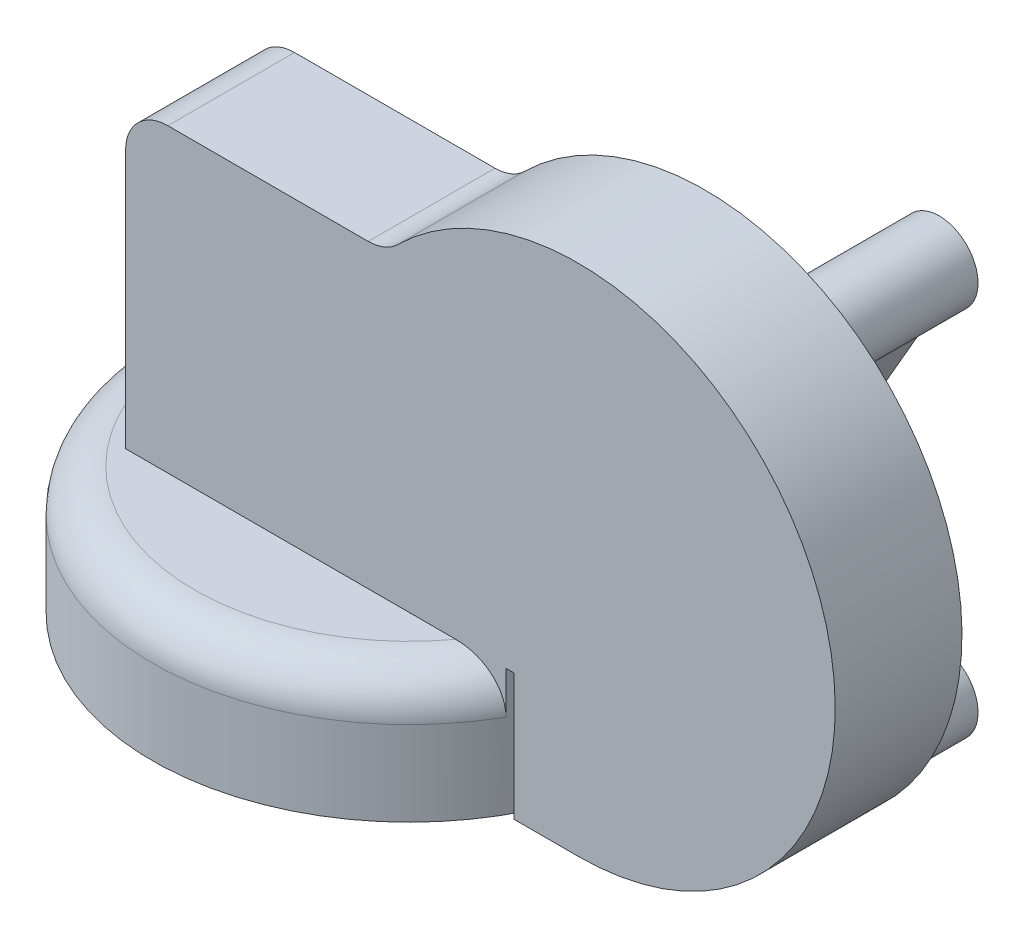
from build123d import *

# Parameters (mm, degrees)
SKETCH1_R           = 30.4
BOSS_EXTRUDE1_DEPTH = 15
BOSS_EXTRUDE7_DEPTH = 15
FILLET2_R           = 5
BOSS_EXTRUDE8_DEPTH = 15


with BuildPart() as part:
    # Sketch1 → Boss-Extrude1 (new body)
    with BuildSketch(Plane(origin=(0, 0, 0), x_dir=(1, 0, 0), z_dir=(0, 1, 0))):
        Circle(SKETCH1_R)
    extrude(amount=BOSS_EXTRUDE1_DEPTH)

    # Sketch2 → Boss-Extrude7 (add)
    with BuildSketch(Plane.XY):
        with BuildLine():
            Line((12.281826966, 50.600114208), (-18.575808631, 50.600114208))
            Line((-18.575808631, 50.600114208), (-18.575808631, 15))
            Line((-18.575808631, 15), (27.386025108, 15))
            Line((27.386025108, 15), (27.386025108, 0))
            Line((27.386025108, 0), (35, 0))
            ThreePointArc((35, 0), (62.733044116, 42.851436224), (12.281826966, 50.600114208))
        make_face()
    extrude(amount=BOSS_EXTRUDE7_DEPTH)

    # Fillet2
    fillet2_edges = [part.edges().sort_by_distance(p)[0] for p in [
        (-18.575808631, 50.600114208, 7.5),
        (12.281826966, 50.600114208, 7.5),
        (-29.393755023, 15, -7.756749685),
    ]]
    fillet(fillet2_edges, radius=FILLET2_R)

    # Sketch4 → Boss-Extrude8 (add)
    with BuildSketch(Plane(origin=(0, 0, 0), x_dir=(-1, 0, 0), z_dir=(0, 0, -1))):
        with BuildLine():
            Line((-43.716283143, 50.097045256), (-35, 35))
            ThreePointArc((-35, 35), (-32.7, 34.383716857), (-31.016283143, 32.7))
            Line((-31.016283143, 32.7), (-13.583716857, 32.7))
            ThreePointArc((-13.583716857, 32.7), (-5, 30.4), (-13.583716857, 28.1))
            Line((-13.583716857, 28.1), (-31.016283143, 28.1))
            ThreePointArc((-31.016283143, 28.1), (-32.7, 26.416283143), (-35, 25.8))
            Line((-35, 25.8), (-43.716283143, 10.702954744))
            ThreePointArc((-43.716283143, 10.702954744), (-50, 4.419237886), (-47.7, 13.002954744))
            Line((-47.7, 13.002954744), (-38.983716857, 28.1))
            ThreePointArc((-38.983716857, 28.1), (-39.6, 30.4), (-38.983716857, 32.7))
            Line((-38.983716857, 32.7), (-47.7, 47.797045256))
            ThreePointArc((-47.7, 47.797045256), (-50, 56.380762114), (-43.716283143, 50.097045256))
        make_face()
    extrude(amount=BOSS_EXTRUDE8_DEPTH)


solid = part.part
